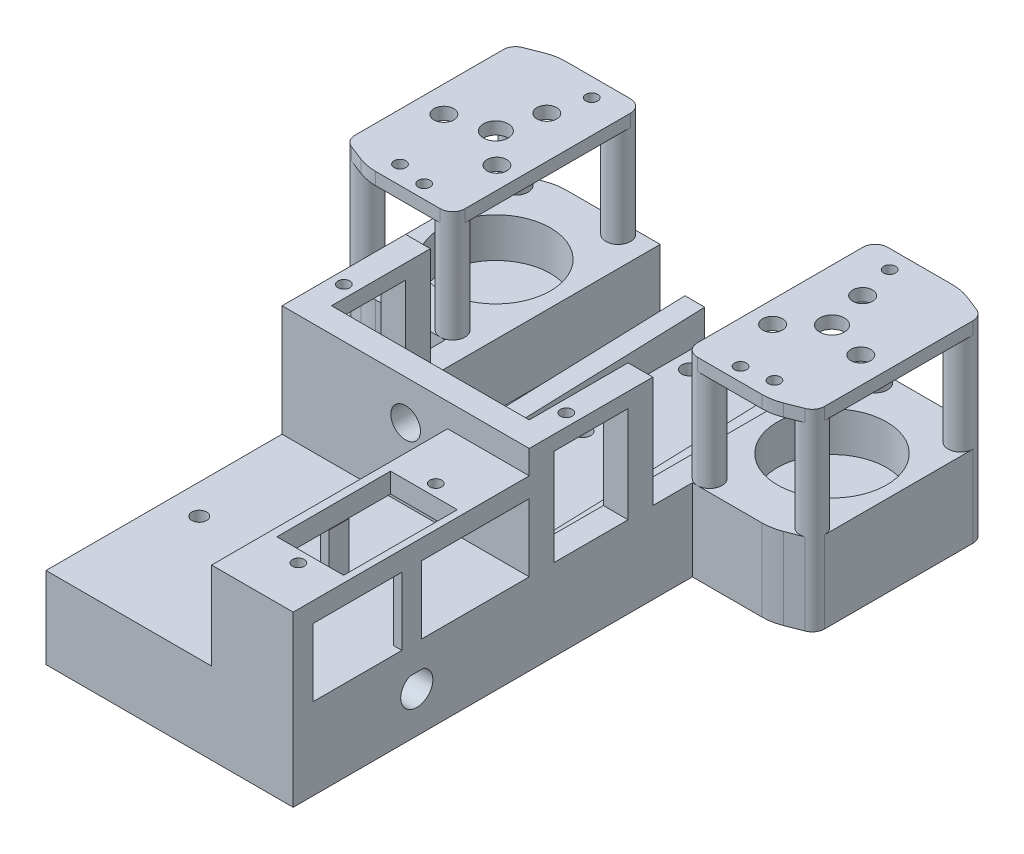
from build123d import *
from build123d.topology import SkipClean

# Parameters (mm, degrees)
SKETCH1_W               = 108
SKETCH1_H               = 40
BOSS_EXTRUDE1_DEPTH     = 16.5
BOSS_EXTRUDE2_START     = 16.5
SKETCH2_R               = 2.5
BOSS_EXTRUDE2_DEPTH     = 20
BOSS_EXTRUDE3_START     = 36.5
BOSS_EXTRUDE3_DEPTH     = 2.5
CUT_EXTRUDE1_START      = 36.5
SKETCH5_R               = 1.2
CUT_EXTRUDE1_DEPTH      = 2.5
FILLET2_R               = 10
SKETCH7_W               = 50
SKETCH7_H               = 80
BOSS_EXTRUDE4_DEPTH     = 16.5
CUT_EXTRUDE2_START      = 39
SKETCH8_R               = 1.2
CUT_EXTRUDE2_DEPTH      = 2.5
CUT_EXTRUDE3_DEPTH      = 121.154067763
CUT_EXTRUDE4_START      = 47.25
CUT_EXTRUDE4_DEPTH      = 165.626530874
BOSS_EXTRUDE5_START     = 25
SKETCH11_W              = 25
SKETCH11_H              = 22.5
BOSS_EXTRUDE5_DEPTH     = 5
BOSS_EXTRUDE6_START     = -25
SKETCH11_2_W            = 25
SKETCH11_2_H            = 22.5
BOSS_EXTRUDE6_DEPTH     = 5
CUT_EXTRUDE5_DEPTH      = 118.376530874
CUT_EXTRUDE5_DEPTH_BACK = 118.376530874
SKETCH12_W              = 15
SKETCH12_H              = 19.5
CUT_EXTRUDE6_START      = 39
SKETCH13_R              = 1.2
CUT_EXTRUDE6_DEPTH      = 3
BOSS_EXTRUDE7_START     = 52.25
SKETCH14_W              = 40
SKETCH14_H              = 22.5
BOSS_EXTRUDE7_DEPTH     = 5
CUT_EXTRUDE8_DEPTH      = 118.376530874
CUT_EXTRUDE8_DEPTH_BACK = 118.376530874
CUT_EXTRUDE9_START      = -15
CUT_EXTRUDE9_DEPTH      = 30
BOSS_EXTRUDE9_START     = 25
BOSS_EXTRUDE9_DEPTH     = 16.5
CUT_EXTRUDE11_START     = 34.2
SKETCH21_R              = 1.2
SKETCH21_W              = 13.5
SKETCH21_H              = 23
CUT_EXTRUDE11_DEPTH     = 4
CUT_EXTRUDE12_START     = 16.5
SKETCH22_R              = 1.5
CUT_EXTRUDE12_DEPTH     = 5.316998125
CUT_EXTRUDE13_START     = 16.5
SKETCH23_R              = 11.05
CUT_EXTRUDE13_DEPTH     = 8
CUT_EXTRUDE14_START     = 39
SKETCH24_R              = 2
SKETCH24_R_2            = 2.5
CUT_EXTRUDE14_DEPTH     = 2.5
SKETCH16_R              = 3
CUT_EXTRUDE15_DEPTH     = 118.376530874
CUT_EXTRUDE16_START     = 78
SKETCH25_W              = 13
SKETCH25_H              = 13.7
CUT_EXTRUDE16_DEPTH     = 4
SKETCH28_R              = 1.6
CUT_EXTRUDE19_DEPTH     = 118.376530874


with BuildPart() as part:
    # Sketch1 → Boss-Extrude1 (new body)
    with BuildSketch(Plane(origin=(0, 0, 0), x_dir=(1, 0, 0), z_dir=(0, 1, 0))):
        Rectangle(SKETCH1_W, SKETCH1_H)
    extrude(amount=BOSS_EXTRUDE1_DEPTH)

    # Sketch2 → Boss-Extrude2 (add)
    with BuildSketch(Plane(origin=(0, 0, 0), x_dir=(1, 0, 0), z_dir=(0, 1, 0)).offset(BOSS_EXTRUDE2_START)):
        with Locations(Location((-45, -15, 0), (0, 0, 90))):
            Circle(SKETCH2_R)
        with Locations(Location((-45, 15, 0), (0, 0, 90))):
            Circle(SKETCH2_R)
        with Locations(Location((-26, 16.75, 0), (0, 0, 90))):
            Circle(SKETCH2_R)
        with Locations(Location((-26, -16.75, 0), (0, 0, 90))):
            Circle(SKETCH2_R)
        with Locations(Location((26, -16.75, 0), (0, 0, 90))):
            Circle(SKETCH2_R)
        with Locations(Location((26, 16.75, 0), (0, 0, 90))):
            Circle(SKETCH2_R)
        with Locations(Location((45, 15, 0), (0, 0, 90))):
            Circle(SKETCH2_R)
        with Locations(Location((45, -15, 0), (0, 0, 90))):
            Circle(SKETCH2_R)
    extrude(amount=BOSS_EXTRUDE2_DEPTH)

    # Sketch3 → Boss-Extrude3 (add)
    with SkipClean():  # the faces are left unmerged after this step: merging them gives an invalid solid
        with BuildSketch(Plane(origin=(0, 0, 0), x_dir=(1, 0, 0), z_dir=(0, 1, 0)).offset(BOSS_EXTRUDE3_START)):
            with BuildLine():
                Line((-26, 19.25), (-41, 19.25))
                Line((-41, 19.25), (-45.911079784, 17.328075091))
                ThreePointArc((-45.911079784, 17.328075091), (-47.064909134, 16.409308437), (-47.5, 15))
                Line((-47.5, 15), (-47.5, -15))
                ThreePointArc((-47.5, -15), (-47.064909134, -16.409308437), (-45.911079784, -17.328075091))
                Line((-45.911079784, -17.328075091), (-41, -19.25))
                Line((-41, -19.25), (-26, -19.25))
                ThreePointArc((-26, -19.25), (-24.232233047, -18.517766953), (-23.5, -16.75))
                Line((-23.5, -16.75), (-23.5, 0))
                Line((-23.5, 0), (-23.5, 16.75))
                ThreePointArc((-23.5, 16.75), (-24.232233047, 18.517766953), (-26, 19.25))
            make_face()
            with BuildLine():
                Line((26, -19.25), (41, -19.25))
                Line((41, -19.25), (45.911079784, -17.328075091))
                ThreePointArc((45.911079784, -17.328075091), (47.064909134, -16.409308437), (47.5, -15))
                Line((47.5, -15), (47.5, 15))
                ThreePointArc((47.5, 15), (47.064909134, 16.409308437), (45.911079784, 17.328075091))
                Line((45.911079784, 17.328075091), (41, 19.25))
                Line((41, 19.25), (26, 19.25))
                ThreePointArc((26, 19.25), (24.232233047, 18.517766953), (23.5, 16.75))
                Line((23.5, 16.75), (23.5, 0))
                Line((23.5, 0), (23.5, -16.75))
                ThreePointArc((23.5, -16.75), (24.232233047, -18.517766953), (26, -19.25))
            make_face()
        extrude(amount=BOSS_EXTRUDE3_DEPTH)

    # Sketch5 → Cut-Extrude1 (cut)
    with SkipClean():  # the faces are left unmerged after this step: merging them gives an invalid solid
        with BuildSketch(Plane(origin=(0, 0, 0), x_dir=(1, 0, 0), z_dir=(0, 1, 0)).offset(CUT_EXTRUDE1_START)):
            with Locations(Location((-30.12924967, 15.52473162, 0), (0, 0, 90))):
                Circle(SKETCH5_R)
            with Locations(Location((-37.87075033, -15.52473162, 0), (0, 0, 90))):
                Circle(SKETCH5_R)
            with Locations(Location((30.12924967, 15.52473162, 0), (0, 0, 90))):
                Circle(SKETCH5_R)
            with Locations(Location((37.87075033, -15.52473162, 0), (0, 0, 90))):
                Circle(SKETCH5_R)
        extrude(amount=CUT_EXTRUDE1_DEPTH, mode=Mode.SUBTRACT)

    # Fillet2
    fillet2_edges = [part.edges().sort_by_distance(p)[0] for p in [
        (-41, 37.75, 19.25),
        (-41, 37.75, -19.25),
        (41, 37.75, -19.25),
        (41, 37.75, 19.25),
    ]]
    fillet(fillet2_edges, radius=FILLET2_R)

    # Sketch7 → Boss-Extrude4 (add)
    with SkipClean():  # the faces are left unmerged after this step: merging them gives an invalid solid
        with BuildSketch(Plane(origin=(0, 0, 0), x_dir=(1, 0, 0), z_dir=(0, 1, 0))):
            with Locations((0, -60)):
                Rectangle(SKETCH7_W, SKETCH7_H)
        extrude(amount=BOSS_EXTRUDE4_DEPTH)

    # Sketch8 → Cut-Extrude2 (cut)
    with SkipClean():  # the faces are left unmerged after this step: merging them gives an invalid solid
        with BuildSketch(Plane(origin=(0, 0, 0), x_dir=(1, 0, 0), z_dir=(0, 1, 0)).offset(CUT_EXTRUDE2_START)):
            with Locations(Location((-32, -16.5, 0), (0, 0, 90))):
                Circle(SKETCH8_R)
            with Locations(Location((32, -16.5, 0), (0, 0, 90))):
                Circle(SKETCH8_R)
        extrude(amount=-CUT_EXTRUDE2_DEPTH, mode=Mode.SUBTRACT)

    # Sketch9 → Cut-Extrude3 (cut, through all)
    with SkipClean():  # the faces are left unmerged after this step: merging them gives an invalid solid
        with BuildSketch(Plane(origin=(0, 0, 0), x_dir=(1, 0, 0), z_dir=(0, 1, 0))):
            with BuildLine():
                Line((-26, 19.25), (-39.112954404, 19.25))
                ThreePointArc((-39.112954404, 19.25), (-40.967273197, 19.076571213), (-42.757273539, 18.562300362))
                Line((-42.757273539, 18.562300362), (-45.911079784, 17.328075091))
                ThreePointArc((-45.911079784, 17.328075091), (-47.064909134, 16.409308437), (-47.5, 15))
                Line((-47.5, 15), (-47.5, -15))
                ThreePointArc((-47.5, -15), (-47.064909134, -16.409308437), (-45.911079784, -17.328075091))
                Line((-45.911079784, -17.328075091), (-42.757273539, -18.562300362))
                ThreePointArc((-42.757273539, -18.562300362), (-40.967273197, -19.076571213), (-39.112954404, -19.25))
                Line((-39.112954404, -19.25), (-26, -19.25))
                Line((-26, -19.25), (-25, -19.25))
                Line((-25, -19.25), (-25, -20))
                Line((-25, -20), (-54, -20))
                Line((-54, -20), (-54, 20))
                Line((-54, 20), (54, 20))
                Line((54, 20), (54, -20))
                Line((54, -20), (25, -20))
                Line((25, -20), (25, -19.25))
                Line((25, -19.25), (26, -19.25))
                Line((26, -19.25), (39.112954404, -19.25))
                ThreePointArc((39.112954404, -19.25), (40.967273197, -19.076571213), (42.757273539, -18.562300362))
                Line((42.757273539, -18.562300362), (45.911079784, -17.328075091))
                ThreePointArc((45.911079784, -17.328075091), (47.064909134, -16.409308437), (47.5, -15))
                Line((47.5, -15), (47.5, 15))
                ThreePointArc((47.5, 15), (47.064909134, 16.409308437), (45.911079784, 17.328075091))
                Line((45.911079784, 17.328075091), (42.757273539, 18.562300362))
                ThreePointArc((42.757273539, 18.562300362), (40.967273197, 19.076571213), (39.112954404, 19.25))
                Line((39.112954404, 19.25), (26, 19.25))
                Line((26, 19.25), (-26, 19.25))
            make_face()
        extrude(amount=CUT_EXTRUDE3_DEPTH, mode=Mode.SUBTRACT)

    # Sketch10 → Cut-Extrude4 (cut, through all)
    with SkipClean():  # the faces are left unmerged after this step: merging them gives an invalid solid
        with BuildSketch(Plane.XY.offset(CUT_EXTRUDE4_START)):
            Polygon((-20, 16.5), (20, 16.5), (20, 4), (15, 4), (15, 10), (11, 10), (11, 4), (-11, 4), (-11, 10), (-15, 10), (-15, 4), (-20, 4), align=None)
        extrude(amount=-CUT_EXTRUDE4_DEPTH, mode=Mode.SUBTRACT)

    # Sketch11 → Boss-Extrude5 (add)
    with SkipClean():  # the faces are left unmerged after this step: merging them gives an invalid solid
        with BuildSketch(Plane(origin=(0, 0, 0), x_dir=(0, 0, -1), z_dir=(1, 0, 0)).offset(BOSS_EXTRUDE5_START)):
            with Locations((-39.75, 27.75)):
                Rectangle(SKETCH11_W, SKETCH11_H)
        extrude(amount=-BOSS_EXTRUDE5_DEPTH)

    # Sketch11<2> → Boss-Extrude6 (add)
    with SkipClean():  # the faces are left unmerged after this step: merging them gives an invalid solid
        with BuildSketch(Plane(origin=(0, 0, 0), x_dir=(0, 0, -1), z_dir=(1, 0, 0)).offset(BOSS_EXTRUDE6_START)):
            with Locations((-39.75, 27.75)):
                Rectangle(SKETCH11_2_W, SKETCH11_2_H)
        extrude(amount=BOSS_EXTRUDE6_DEPTH)

    # Sketch12 → Cut-Extrude5 (cut, two sides: drawn at the far end of the back side and taken through both)
    with SkipClean():  # the faces are left unmerged after this step: merging them gives an invalid solid
        with BuildSketch(Plane(origin=(0, 0, 0), x_dir=(0, 0, -1), z_dir=(1, 0, 0)).offset(-CUT_EXTRUDE5_DEPTH_BACK)):
            with Locations((-39.75, 26.25)):
                Rectangle(SKETCH12_W, SKETCH12_H)
        extrude(amount=CUT_EXTRUDE5_DEPTH + CUT_EXTRUDE5_DEPTH_BACK, mode=Mode.SUBTRACT)

    # Sketch13 → Cut-Extrude6 (cut)
    with SkipClean():  # the faces are left unmerged after this step: merging them gives an invalid solid
        with BuildSketch(Plane(origin=(0, 0, 0), x_dir=(1, 0, 0), z_dir=(0, 1, 0)).offset(CUT_EXTRUDE6_START)):
            with Locations(Location((-22.5, -42.25, 0), (0, 0, 270))):
                Circle(SKETCH13_R)
            with Locations(Location((22.5, -42.25, 0), (0, 0, 270))):
                Circle(SKETCH13_R)
        extrude(amount=-CUT_EXTRUDE6_DEPTH, mode=Mode.SUBTRACT)

    # Sketch14 → Boss-Extrude7 (add)
    with SkipClean():  # the faces are left unmerged after this step: merging them gives an invalid solid
        with BuildSketch(Plane.XY.offset(BOSS_EXTRUDE7_START)):
            with Locations((0, 27.75)):
                Rectangle(SKETCH14_W, SKETCH14_H)
        extrude(amount=-BOSS_EXTRUDE7_DEPTH)

    # Sketch17 → Cut-Extrude8 (cut, two sides: drawn at the far end of the back side and taken through both)
    with SkipClean():  # the faces are left unmerged after this step: merging them gives an invalid solid
        with BuildSketch(Plane(origin=(0, 0, 0), x_dir=(0, 0, -1), z_dir=(1, 0, 0)).offset(-CUT_EXTRUDE8_DEPTH_BACK)):
            with BuildLine():
                Line((-76.4, 11.183001875), (-73.6, 11.183001875))
                ThreePointArc((-73.6, 11.183001875), (-75, 5), (-76.4, 11.183001875))
            make_face()
        extrude(amount=CUT_EXTRUDE8_DEPTH + CUT_EXTRUDE8_DEPTH_BACK, mode=Mode.SUBTRACT)

    # Sketch19 → Cut-Extrude9 (cut)
    with SkipClean():  # the faces are left unmerged after this step: merging them gives an invalid solid
        with BuildSketch(Plane(origin=(0, 0, 0), x_dir=(0, 0, -1), z_dir=(1, 0, 0)).offset(CUT_EXTRUDE9_START)):
            Polygon((19.25, 10), (-47.25, 7.677768829), (-47.25, 10), align=None)
        extrude(amount=CUT_EXTRUDE9_DEPTH, mode=Mode.SUBTRACT)

    # Sketch20 → Boss-Extrude9 (add)
    with SkipClean():  # the faces are left unmerged after this step: merging them gives an invalid solid
        with BuildSketch(Plane(origin=(0, 0, 0), x_dir=(0, 0, -1), z_dir=(1, 0, 0)).offset(BOSS_EXTRUDE9_START)):
            Polygon((-100, 16.5), (-100, 34.2), (-52.25, 34.2), (-52.25, 30.2), (-74, 30.2), (-74, 16.5), (-78, 16.5), (-78, 30.2), (-96, 30.2), (-96, 16.5), align=None)
        extrude(amount=-BOSS_EXTRUDE9_DEPTH)

    # Sketch21 → Cut-Extrude11 (cut)
    with SkipClean():  # the faces are left unmerged after this step: merging them gives an invalid solid
        with BuildSketch(Plane(origin=(0, 0, 0), x_dir=(1, 0, 0), z_dir=(0, 1, 0)).offset(CUT_EXTRUDE11_START)):
            with Locations(Location((16.9, -63.05, 0), (0, 0, 270))):
                Circle(SKETCH21_R)
            with Locations(Location((16.9, -90.85, 0), (0, 0, 270))):
                Circle(SKETCH21_R)
            with Locations((16.9, -76.95)):
                Rectangle(SKETCH21_W, SKETCH21_H)
        extrude(amount=-CUT_EXTRUDE11_DEPTH, mode=Mode.SUBTRACT)

    # Sketch22 → Cut-Extrude12 (cut)
    with SkipClean():  # the faces are left unmerged after this step: merging them gives an invalid solid
        with BuildSketch(Plane(origin=(0, 0, 0), x_dir=(1, 0, 0), z_dir=(0, 1, 0)).offset(CUT_EXTRUDE12_START)):
            with Locations(Location((-19, -75, 0), (0, 0, 248.960530219))):
                Circle(SKETCH22_R)
            with Locations(Location((-7, -75, 0), (0, 0, 248.960530219))):
                Circle(SKETCH22_R)
            with Locations(Location((5, -75, 0), (0, 0, 291.039469781))):
                Circle(SKETCH22_R)
        extrude(amount=-CUT_EXTRUDE12_DEPTH, mode=Mode.SUBTRACT)

    # Sketch23 → Cut-Extrude13 (cut)
    with SkipClean():  # the faces are left unmerged after this step: merging them gives an invalid solid
        with BuildSketch(Plane(origin=(0, 0, 0), x_dir=(1, 0, 0), z_dir=(0, 1, 0)).offset(CUT_EXTRUDE13_START)):
            with Locations(Location((-34, 0, 0), (0, 0, 90))):
                Circle(SKETCH23_R)
            with Locations(Location((34, 0, 0), (0, 0, 90))):
                Circle(SKETCH23_R)
        extrude(amount=-CUT_EXTRUDE13_DEPTH, mode=Mode.SUBTRACT)

    # Sketch24 → Cut-Extrude14 (cut)
    with SkipClean():  # the faces are left unmerged after this step: merging them gives an invalid solid
        with BuildSketch(Plane(origin=(0, 0, 0), x_dir=(1, 0, 0), z_dir=(0, 1, 0)).offset(CUT_EXTRUDE14_START)):
            with Locations(Location((-31.943663887, 8.247513673, 0), (0, 0, 90))):
                Circle(SKETCH24_R)
            with Locations(Location((-27.885611697, -5.904596149, 0), (0, 0, 90))):
                Circle(SKETCH24_R)
            with Locations(Location((-42.170724415, -2.342917524, 0), (0, 0, 90))):
                Circle(SKETCH24_R)
            with Locations(Location((31.943663887, 8.247513673, 0), (0, 0, 90))):
                Circle(SKETCH24_R)
            with Locations(Location((27.885611697, -5.904596149, 0), (0, 0, 90))):
                Circle(SKETCH24_R)
            with Locations(Location((42.170724415, -2.342917524, 0), (0, 0, 90))):
                Circle(SKETCH24_R)
            with Locations(Location((-34, 0, 0), (0, 0, 90))):
                Circle(SKETCH24_R_2)
            with Locations(Location((34, 0, 0), (0, 0, 90))):
                Circle(SKETCH24_R_2)
        extrude(amount=-CUT_EXTRUDE14_DEPTH, mode=Mode.SUBTRACT)

    # Sketch16 → Cut-Extrude15 (cut, through all)
    with SkipClean():  # the faces are left unmerged after this step: merging them gives an invalid solid
        with BuildSketch(Plane.XY):
            with Locations((0, 31)):
                Circle(SKETCH16_R)
        extrude(amount=CUT_EXTRUDE15_DEPTH, mode=Mode.SUBTRACT)

    # Sketch25 → Cut-Extrude16 (cut)
    with SkipClean():  # the faces are left unmerged after this step: merging them gives an invalid solid
        with BuildSketch(Plane.XY.offset(CUT_EXTRUDE16_START)):
            with Locations((16.75, 23.35)):
                Rectangle(SKETCH25_W, SKETCH25_H)
        extrude(amount=-CUT_EXTRUDE16_DEPTH, mode=Mode.SUBTRACT)

    # Sketch28 → Cut-Extrude19 (cut, through all)
    with SkipClean():  # the faces are left unmerged after this step: merging them gives an invalid solid
        with BuildSketch(Plane(origin=(0, 0, 0), x_dir=(1, 0, 0), z_dir=(0, 1, 0))):
            with Locations(Location((7.62, -8.795, 0), (0, 0, 90))):
                Circle(SKETCH28_R)
            with Locations(Location((7.62, 12.795, 0), (0, 0, 90))):
                Circle(SKETCH28_R)
            with Locations(Location((-7.62, -8.795, 0), (0, 0, 90))):
                Circle(SKETCH28_R)
            with Locations(Location((-7.62, 12.795, 0), (0, 0, 90))):
                Circle(SKETCH28_R)
        extrude(amount=CUT_EXTRUDE19_DEPTH, mode=Mode.SUBTRACT)


solid = part.part
